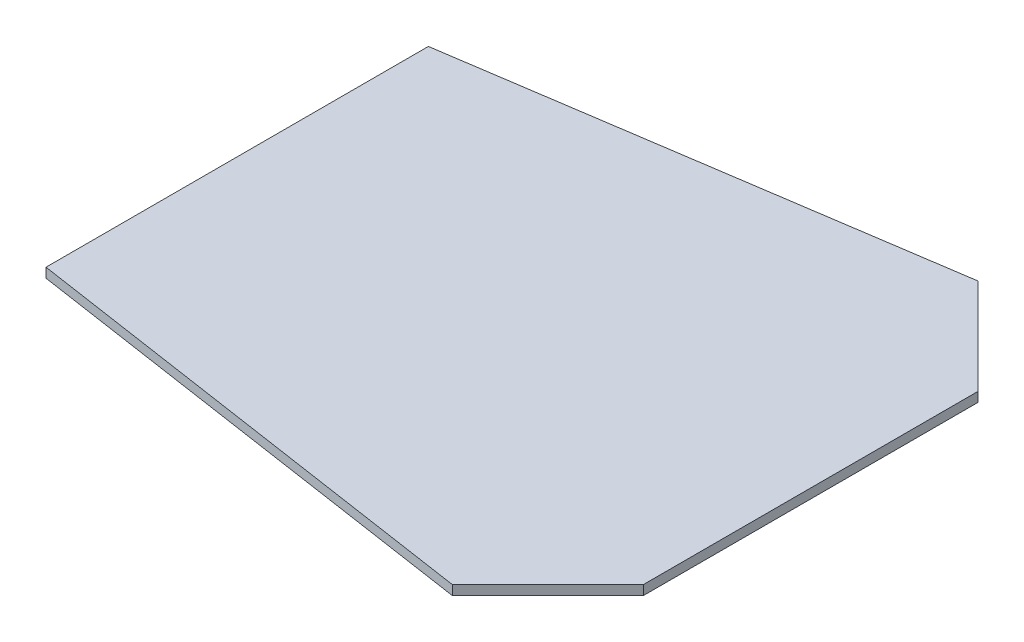
from build123d import *

# Parameters (mm, degrees)
BOSS_EXTRUDE1_DEPTH = 10


with BuildPart() as part:
    # Sketch1 → Boss-Extrude1 (new body)
    with BuildSketch(Plane(origin=(0, 0, 0), x_dir=(1, 0, 0), z_dir=(0, 1, 0))):
        Polygon((0, 200), (0, -200), (500, -275), (600, -175), (600, 175), (500, 275), align=None)
    extrude(amount=BOSS_EXTRUDE1_DEPTH)


solid = part.part
